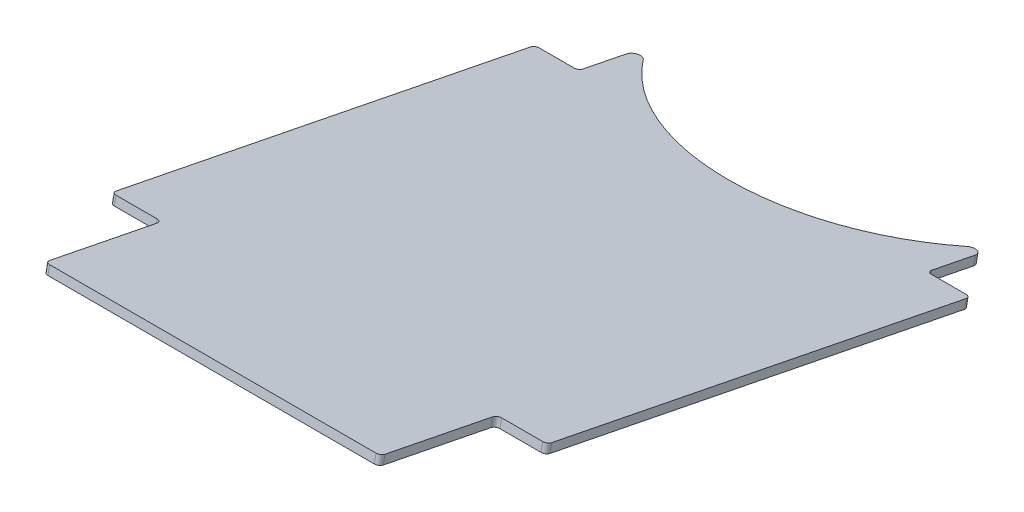
from build123d import *

# Parameters (mm, degrees)
BOSS_EXTRUDE1_DEPTH = 317.5
SKETCH2_W           = 31.75
SKETCH2_H           = 70.720826982
SKETCH2_W_2         = 36.5125
SKETCH2_H_2         = 48.495826983
CUT_EXTRUDE1_DEPTH  = 545.567062068
SKETCH5_W           = 244.475
SKETCH5_H           = 38.1
BOSS_EXTRUDE2_DEPTH = 6.35
CUT_EXTRUDE3_DEPTH  = 576.982243044
FILLET3_R           = 5.08
FILLET4_R           = 3.302


with BuildPart() as part:
    # Sketch1 → Boss-Extrude1 (new body)
    with BuildSketch(Plane(origin=(0, 0, 0), x_dir=(0, 0, -1), z_dir=(1, 0, 0))):
        Polygon((0, 38.1), (-1.238823545, 31.872013469), (-426.688823545, 116.499280171), (-425.45, 122.727266702), align=None)
    extrude(amount=BOSS_EXTRUDE1_DEPTH)

    # Sketch2 → Cut-Extrude1 (cut, through all)
    with BuildSketch(Plane(origin=(0, 36.649905094, -7.290119387), x_dir=(1, 0, 0), z_dir=(0, 0.9807852804032319, -0.1950903220161215))):
        with Locations((15.875, -42.79335476)):
            Rectangle(SKETCH2_W, SKETCH2_H)
        with Locations((18.25625, -416.970086038)):
            Rectangle(SKETCH2_W_2, SKETCH2_H_2)
        with Locations((301.625, -42.79335476)):
            Rectangle(SKETCH2_W, SKETCH2_H)
        with Locations((299.24375, -416.970086038)):
            Rectangle(SKETCH2_W_2, SKETCH2_H_2)
    extrude(amount=-CUT_EXTRUDE1_DEPTH, mode=Mode.SUBTRACT)

    # Sketch5 → Boss-Extrude2 (add)
    with BuildSketch(Plane(origin=(0, 30.421918564, -6.051295842), x_dir=(1, 0, 0), z_dir=(0, -0.9807852804032319, 0.1950903220161215))):
        with Locations((158.75, 460.267999529)):
            Rectangle(SKETCH5_W, SKETCH5_H)
    extrude(amount=-BOSS_EXTRUDE2_DEPTH)

    # Sketch6 → Cut-Extrude3 (cut, through all)
    with BuildSketch(Plane(origin=(0, 30.421918564, -6.051295842), x_dir=(1, 0, 0), z_dir=(0, -0.9807852804032319, 0.1950903220161215))):
        with BuildLine():
            Line((31.75, 26.482941269), (31.75, 7.432941269))
            Line((31.75, 7.432941269), (285.75, 7.432941269))
            Line((285.75, 7.432941269), (285.75, 26.482941269))
            ThreePointArc((285.75, 26.482941269), (158.75, 96.332941269), (31.75, 26.482941269))
        make_face()
    extrude(amount=-CUT_EXTRUDE3_DEPTH, mode=Mode.SUBTRACT)

    # Fillet3
    fillet3_edges = [part.edges().sort_by_distance(p)[0] for p in [
        (285.75, 38.702477369, 19.303371364),
        (31.75, 38.702477369, 19.303371364),
    ]]
    fillet(fillet3_edges, radius=FILLET3_R)

    # Fillet4
    fillet4_edges = [part.edges().sort_by_distance(p)[0] for p in [
        (0, 48.782955644, 69.981357895),
        (0, 110.152206934, 378.505418507),
        (317.5, 110.152206934, 378.505418507),
        (317.5, 48.782955644, 69.981357895),
        (36.5125, 110.152206934, 378.505418507),
        (285.75, 48.782955644, 69.981357895),
        (280.9875, 110.152206934, 378.505418507),
        (31.75, 48.782955644, 69.981357895),
        (36.5125, 127.046214705, 463.437330956),
        (280.9875, 127.046214705, 463.437330956),
    ]]
    fillet(fillet4_edges, radius=FILLET4_R)


solid = part.part
